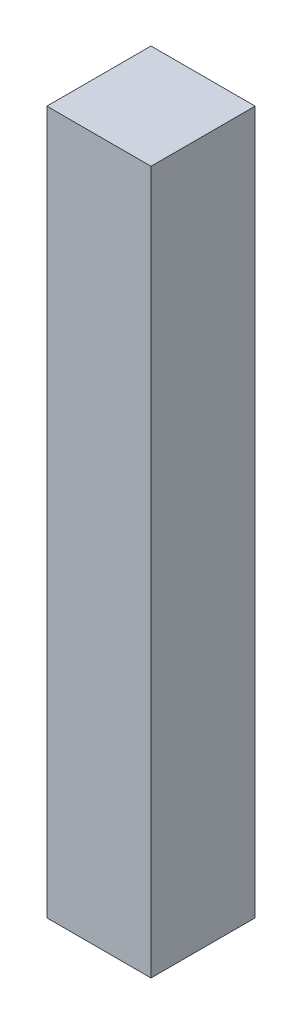
from build123d import *

# Parameters (mm, degrees)
SKETCH_1_W      = 0.8
SKETCH_1_H      = 5.4
EXTRUDE_1_DEPTH = 0.8


with BuildPart() as part:
    # 草图1 → 凸台-拉伸1 (new body)
    with BuildSketch(Plane.XY):
        with Locations((0.4, -1.07402663)):
            Rectangle(SKETCH_1_W, SKETCH_1_H)
    extrude(amount=EXTRUDE_1_DEPTH)


solid = part.part
